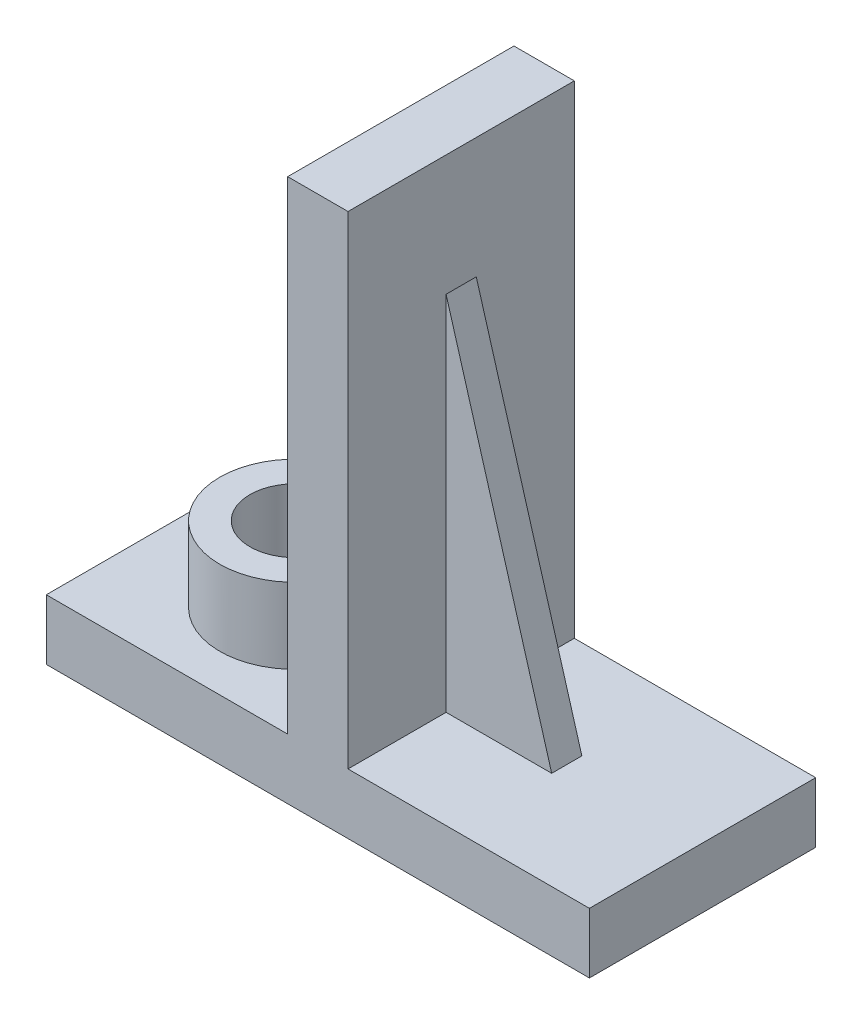
from build123d import *

# Parameters (mm, degrees)
SKETCH1_W           = 72
SKETCH1_H           = 72
BOSS_EXTRUDE1_DEPTH = 15
SKETCH4_W           = 32
SKETCH4_H           = 64
CUT_EXTRUDE1_DEPTH  = 30
SKETCH8_R           = 10
SKETCH8_R_2         = 6
BOSS_EXTRUDE2_DEPTH = 10
BOSS_EXTRUDE3_DEPTH = 2


with BuildPart() as part:
    # Sketch1 → Boss-Extrude1 (new, symmetric)
    with BuildSketch(Plane.XY):
        with Locations((36, 36)):
            Rectangle(SKETCH1_W, SKETCH1_H)
    extrude(amount=BOSS_EXTRUDE1_DEPTH, both=True)

    # Sketch4 → Cut-Extrude1 (cut)
    with BuildSketch(Plane.XY.offset(15)):
        with Locations((56, 40)):
            Rectangle(SKETCH4_W, SKETCH4_H)
        with Locations((16, 40)):
            Rectangle(SKETCH4_W, SKETCH4_H)
    extrude(amount=-CUT_EXTRUDE1_DEPTH, mode=Mode.SUBTRACT)

    # Sketch8 → Boss-Extrude2 (add)
    with BuildSketch(Plane(origin=(0, 8, 0), x_dir=(1, 0, 0), z_dir=(0, 1, 0))):
        with Locations((18, 0)):
            Circle(SKETCH8_R)
        with Locations(Location((18, 0, 0), (0, 0, 180))):
            Circle(SKETCH8_R_2, mode=Mode.SUBTRACT)
    extrude(amount=BOSS_EXTRUDE2_DEPTH)

    # Sketch10 → Boss-Extrude3 (add, symmetric)
    with BuildSketch(Plane.XY):
        Polygon((40, 56), (54, 8), (72, 8), (72, 0), (0, 0), (0, 8), (32, 8), (32, 72), (40, 72), align=None)
    extrude(amount=BOSS_EXTRUDE3_DEPTH, both=True)


solid = part.part
